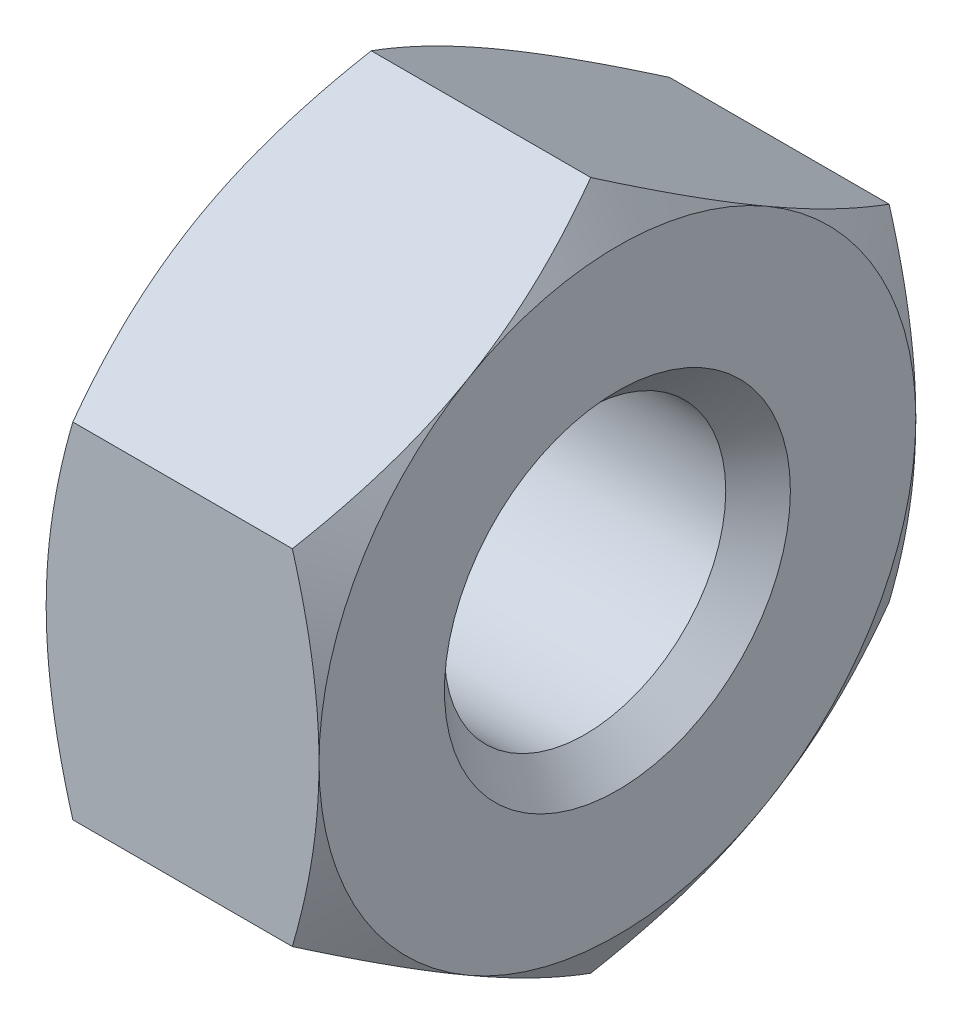
from build123d import *

# Parameters (mm, degrees)
SKETCH1_R           = 1.65
BOSS_EXTRUDE1_DEPTH = 1.6
CHAMFER1_SIZE       = 0.379


with BuildPart() as part:
    # Sketch1 → Boss-Extrude1 (new, symmetric)
    with BuildSketch(Plane(origin=(0, 0, 0), x_dir=(0, 0, -1), z_dir=(1, 0, 0))):
        Polygon((3.5, 2.020725942), (3.5, -2.020725942), (0, -4.041451884), (-3.5, -2.020725942), (-3.5, 2.020725942), (0, 4.041451884), align=None)
        Circle(SKETCH1_R, mode=Mode.SUBTRACT)
    extrude(amount=BOSS_EXTRUDE1_DEPTH, both=True)

    # Sketch4 → Cut-Revolve1 (revolve, cut)
    with BuildSketch(Plane.XY):
        Polygon((-1.6, 3.5), (-1.6, 5.227530151), (-0.602610002, 5.227530151), align=None)
    cut_revolve1 = revolve(axis=Axis((-2.7190736, 0, 0), (1, 0, 0)), mode=Mode.SUBTRACT)

    # Mirror1: Cut-Revolve1 across plane
    add(cut_revolve1.mirror(Plane(origin=(0, 0, 0), x_dir=(0, 0, 1), z_dir=(1, 0, 0))), mode=Mode.SUBTRACT)

    # Chamfer1
    chamfer1_edges = [part.edges().sort_by_distance(p)[0] for p in [
        (-1.6, 0, 1.65),
        (1.6, 0, 1.65),
    ]]
    chamfer(chamfer1_edges, length=CHAMFER1_SIZE)


solid = part.part
